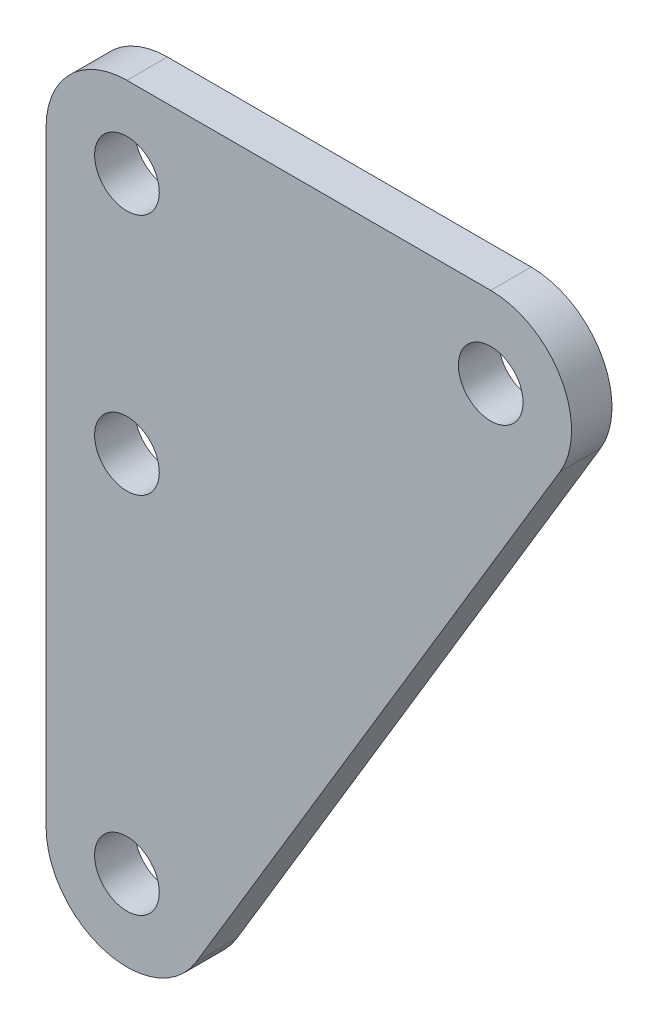
from build123d import *

# Parameters (mm, degrees)
SKETCH1_R           = 4
BOSS_EXTRUDE1_DEPTH = 5


with BuildPart() as part:
    # Sketch1 → Boss-Extrude1 (new body)
    with BuildSketch(Plane.XY):
        with BuildLine():
            Line((-10, -45), (-10, 30))
            ThreePointArc((-10, 30), (-7.071067812, 37.071067812), (0, 40))
            Line((0, 40), (45, 40))
            ThreePointArc((45, 40), (53.701999068, 34.92698815), (53.574929257, 24.855042446))
            Line((53.574929257, 24.855042446), (8.574929257, -50.144957554))
            ThreePointArc((8.574929257, -50.144957554), (-2.669335819, -54.637149282), (-10, -45))
        make_face()
        Circle(SKETCH1_R, mode=Mode.SUBTRACT)
        with Locations((0, -45)):
            Circle(SKETCH1_R, mode=Mode.SUBTRACT)
        with Locations((0, 30)):
            Circle(SKETCH1_R, mode=Mode.SUBTRACT)
        with Locations((45, 30)):
            Circle(SKETCH1_R, mode=Mode.SUBTRACT)
    extrude(amount=BOSS_EXTRUDE1_DEPTH)


solid = part.part
